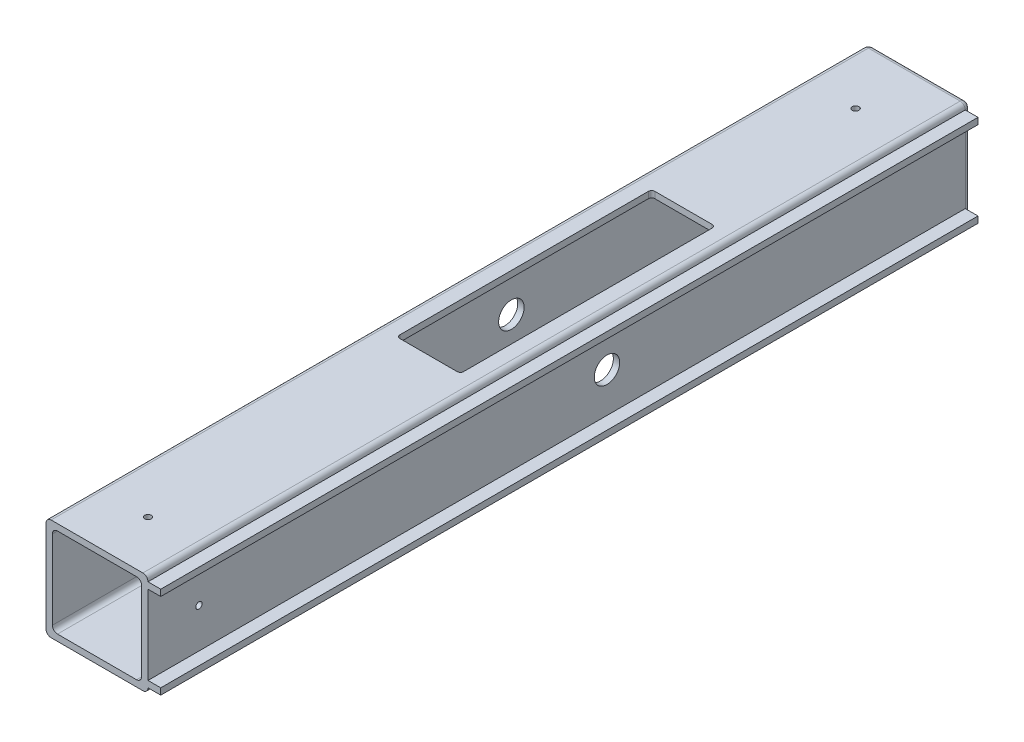
from build123d import *

# Parameters (mm, degrees)
BOSS_EXTRUDE1_DEPTH      = 406.4
BOSS_EXTRUDE1_DEPTH_BACK = 3.175
SKETCH1_W                = 50.8
SKETCH1_H                = 50.8
SKETCH1_W_2              = 44.45
SKETCH1_H_2              = 44.45
SKETCH1_3_W              = 44.45
SKETCH1_3_H              = 44.45
SKETCH1_3_W_2            = 25.4
SKETCH1_3_H_2            = 25.4
BOSS_EXTRUDE2_DEPTH      = 3.175
SKETCH1_4_W              = 25.4
SKETCH1_4_H              = 25.4
BOSS_EXTRUDE3_DEPTH      = 3.175
CUT_EXTRUDE3_REACH       = 414.701
SKETCH4_R                = 1.5875
SKETCH4_R_2              = 1.651
SKETCH4_W                = 31.75
SKETCH4_H                = 127
CUT_EXTRUDE4_REACH       = 414.701
SKETCH5_R                = 1.5875
SKETCH5_R_2              = 6.35
FILLET1_R                = 2.54
FILLET4_R                = 2.54
SKETCH7_W                = 407.035
SKETCH7_H                = 3.175
BOSS_EXTRUDE4_DEPTH      = 6.35
FILLET5_R                = 1.5875


with BuildPart() as part:
    # Sketch1 → Boss-Extrude1 (new, two sides: drawn at the far end of the back side and taken through both)
    with BuildSketch(Plane.XY.offset(-BOSS_EXTRUDE1_DEPTH_BACK)):
        with Locations((25.4, 25.4)):
            Rectangle(SKETCH1_W, SKETCH1_H)
        with Locations((25.4, 25.4)):
            Rectangle(SKETCH1_W_2, SKETCH1_H_2, mode=Mode.SUBTRACT)
    extrude(amount=BOSS_EXTRUDE1_DEPTH + BOSS_EXTRUDE1_DEPTH_BACK)

    # Sketch1<3> → Boss-Extrude2 (add)
    with BuildSketch(Plane.XY):
        with Locations((25.4, 25.4)):
            Rectangle(SKETCH1_3_W, SKETCH1_3_H)
        with Locations((25.4, 25.4)):
            Rectangle(SKETCH1_3_W_2, SKETCH1_3_H_2, mode=Mode.SUBTRACT)
    extrude(amount=-BOSS_EXTRUDE2_DEPTH)

    # Sketch1<4> → Boss-Extrude3 (add)
    with BuildSketch(Plane.XY):
        with Locations((25.4, 25.4)):
            Rectangle(SKETCH1_4_W, SKETCH1_4_H)
    extrude(amount=-BOSS_EXTRUDE3_DEPTH)

    # Cut-Extrude3: up to this face of the body (flat: up to its plane)
    cut_extrude3_end = Plane(part.part.faces().sort_by_distance((25.4, 0, 201.6125))[0])
    # Sketch4 → Cut-Extrude3 (cut, up to the picked face)
    with BuildSketch(Plane(origin=(0, 50.8, 0), x_dir=(1, 0, 0), z_dir=(0, 1, 0)), mode=Mode.PRIVATE) as cut_extrude3_sk1:
        with Locations(Location((25.4, -381, 0), (0, 0, 270))):
            Circle(SKETCH4_R)
    cut_extrude3_tool1 = split(extrude(cut_extrude3_sk1.sketch, amount=-CUT_EXTRUDE3_REACH, mode=Mode.PRIVATE), bisect_by=cut_extrude3_end, keep=Keep.BOTH, mode=Mode.PRIVATE)
    # Sketch4 → Cut-Extrude3 (cut, up to the picked face)
    with BuildSketch(Plane(origin=(0, 50.8, 0), x_dir=(1, 0, 0), z_dir=(0, 1, 0)), mode=Mode.PRIVATE) as cut_extrude3_sk2:
        with Locations(Location((25.4, -28.575, 0), (0, 0, 270))):
            Circle(SKETCH4_R_2)
    cut_extrude3_tool2 = split(extrude(cut_extrude3_sk2.sketch, amount=-CUT_EXTRUDE3_REACH, mode=Mode.PRIVATE), bisect_by=cut_extrude3_end, keep=Keep.BOTH, mode=Mode.PRIVATE)
    # Sketch4 → Cut-Extrude3 (cut, up to the picked face)
    with BuildSketch(Plane(origin=(0, 50.8, 0), x_dir=(1, 0, 0), z_dir=(0, 1, 0)), mode=Mode.PRIVATE) as cut_extrude3_sk3:
        with Locations((25.4, -177.8)):
            Rectangle(SKETCH4_W, SKETCH4_H)
    cut_extrude3_tool3 = split(extrude(cut_extrude3_sk3.sketch, amount=-CUT_EXTRUDE3_REACH, mode=Mode.PRIVATE), bisect_by=cut_extrude3_end, keep=Keep.BOTH, mode=Mode.PRIVATE)
    add(cut_extrude3_tool1.solids().sort_by(Axis((25.4, 50.8, 381), (0, -1, 0)))[0], mode=Mode.SUBTRACT)
    add(cut_extrude3_tool2.solids().sort_by(Axis((25.4, 50.8, 28.575), (0, -1, 0)))[0], mode=Mode.SUBTRACT)
    add(cut_extrude3_tool3.solids().sort_by(Axis((25.4, 50.8, 177.8), (0, -1, 0)))[0], mode=Mode.SUBTRACT)

    # Cut-Extrude4: up to this face of the body (flat: up to its plane)
    cut_extrude4_end = Plane(part.part.faces().sort_by_distance((0, 25.4, 201.6125))[0])
    # Sketch5 → Cut-Extrude4 (cut, up to the picked face)
    with BuildSketch(Plane(origin=(50.8, 0, 0), x_dir=(0, 0, -1), z_dir=(1, 0, 0)), mode=Mode.PRIVATE) as cut_extrude4_sk1:
        with Locations((-381, 25.4)):
            Circle(SKETCH5_R)
    cut_extrude4_tool1 = split(extrude(cut_extrude4_sk1.sketch, amount=-CUT_EXTRUDE4_REACH, mode=Mode.PRIVATE), bisect_by=cut_extrude4_end, keep=Keep.BOTH, mode=Mode.PRIVATE)
    # Sketch5 → Cut-Extrude4 (cut, up to the picked face)
    with BuildSketch(Plane(origin=(50.8, 0, 0), x_dir=(0, 0, -1), z_dir=(1, 0, 0)), mode=Mode.PRIVATE) as cut_extrude4_sk2:
        with Locations((-177.8, 25.4)):
            Circle(SKETCH5_R_2)
    cut_extrude4_tool2 = split(extrude(cut_extrude4_sk2.sketch, amount=-CUT_EXTRUDE4_REACH, mode=Mode.PRIVATE), bisect_by=cut_extrude4_end, keep=Keep.BOTH, mode=Mode.PRIVATE)
    add(cut_extrude4_tool1.solids().sort_by(Axis((50.8, 25.4, 381), (-1, 0, 0)))[0], mode=Mode.SUBTRACT)
    add(cut_extrude4_tool2.solids().sort_by(Axis((50.8, 25.4, 177.8), (-1, 0, 0)))[0], mode=Mode.SUBTRACT)

    # Fillet1
    fillet1_edges = [part.edges().sort_by_distance(p)[0] for p in [
        (0, 0, 201.6125),
        (0, 50.8, 201.6125),
        (50.8, 50.8, 201.6125),
        (50.8, 0, 201.6125),
        (25.4, 0, -3.175),
        (50.8, 25.4, -3.175),
        (25.4, 50.8, -3.175),
        (0, 25.4, -3.175),
    ]]
    fillet(fillet1_edges, radius=FILLET1_R)

    # Fillet4
    fillet4_edges = [part.edges().sort_by_distance(p)[0] for p in [
        (3.175, 47.625, 203.2),
        (3.175, 3.175, 203.2),
        (47.625, 47.625, 203.2),
        (47.625, 3.175, 203.2),
    ]]
    fillet(fillet4_edges, radius=FILLET4_R)

    # Sketch7 → Boss-Extrude4 (add)
    with BuildSketch(Plane(origin=(50.8, 0, 0), x_dir=(0, 0, -1), z_dir=(1, 0, 0))):
        with Locations((-202.8825, 46.6725)):
            Rectangle(SKETCH7_W, SKETCH7_H)
        with Locations((-202.8825, 4.1275)):
            Rectangle(SKETCH7_W, SKETCH7_H)
    extrude(amount=BOSS_EXTRUDE4_DEPTH)

    # Fillet5
    fillet5_edges = [part.edges().sort_by_distance(p)[0] for p in [
        (9.525, 1.5875, 114.3),
        (9.525, 1.5875, 241.3),
        (41.275, 1.5875, 241.3),
        (41.275, 1.5875, 114.3),
        (9.525, 49.2125, 114.3),
        (9.525, 49.2125, 241.3),
        (41.275, 49.2125, 241.3),
        (41.275, 49.2125, 114.3),
    ]]
    fillet(fillet5_edges, radius=FILLET5_R)


solid = part.part
